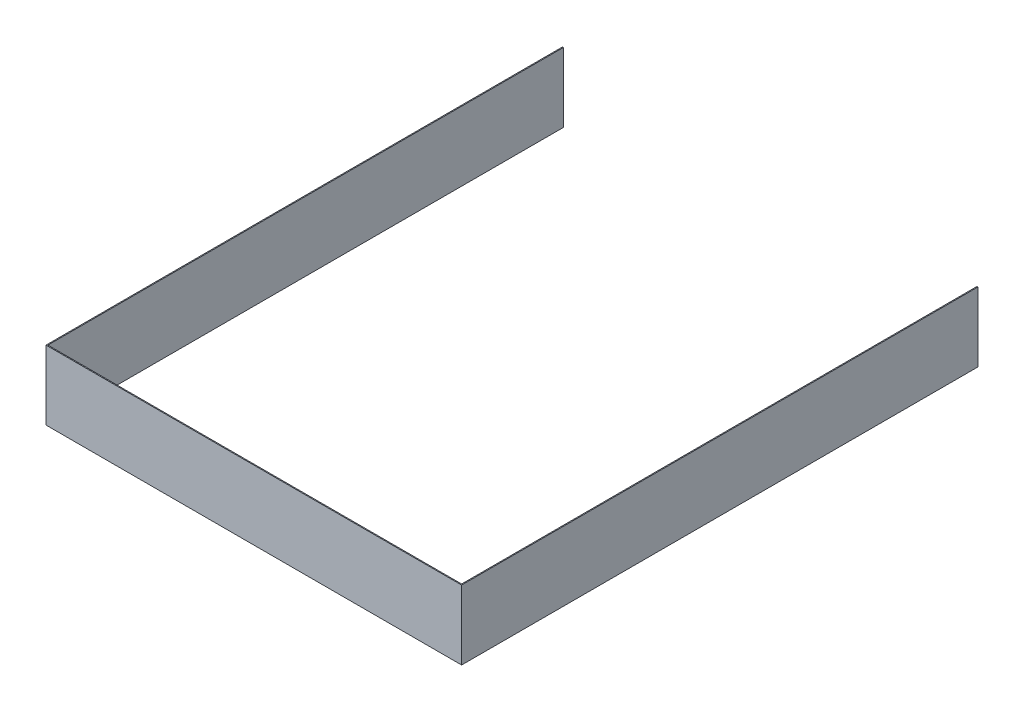
from build123d import *

# Parameters (mm, degrees)
PACK_PLINT_U_1_START = 10
PACK_PLINT_U_1_DEPTH = 110


with BuildPart() as part:
    # Sketch1 → PACK_plint_U_1 (new body)
    with BuildSketch(Plane(origin=(0, 0, 0), x_dir=(1, 0, 0), z_dir=(0, 1, 0)).offset(PACK_PLINT_U_1_START)):
        Polygon((20, 800), (20, -20), (680, -20), (680, 800), (678.5, 800), (678.5, -18.5), (21.5, -18.5), (21.5, 800), align=None)
    extrude(amount=PACK_PLINT_U_1_DEPTH)


solid = part.part
